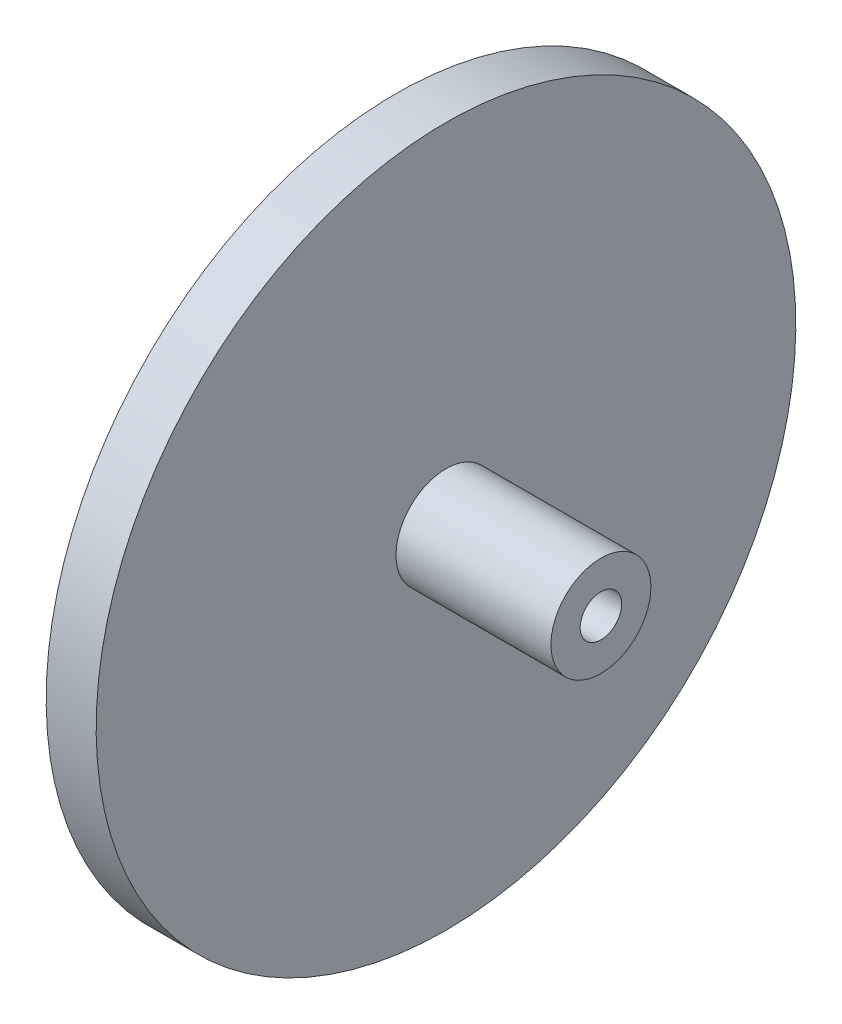
from build123d import *

# Parameters (mm, degrees)
SKETCH3_R          = 2.6416
CUT_EXTRUDE1_DEPTH = 69.039887015


with BuildPart() as part:
    # Sketch2 → Revolve1 (revolve)
    with BuildSketch(Plane.XY, mode=Mode.PRIVATE) as revolve1_sk:
        Polygon((41.91, 44.45), (48.26, 44.45), (48.26, 6.35), (67.945, 6.35), (67.945, 0), (41.91, 0), align=None)
    revolve(revolve1_sk.sketch.rotate(Axis((41.91, 0, 0), (1, 0, 0)), 180), axis=Axis((41.91, 0, 0), (1, 0, 0)))

    # Sketch3 → Cut-Extrude1 (cut, through all)
    with BuildSketch(Plane(origin=(67.945, 0, 0), x_dir=(0, 0, -1), z_dir=(1, 0, 0))):
        with Locations(Location((0, 0, 0), (0, 0, 90))):
            Circle(SKETCH3_R)
    extrude(amount=-CUT_EXTRUDE1_DEPTH, mode=Mode.SUBTRACT)


solid = part.part
